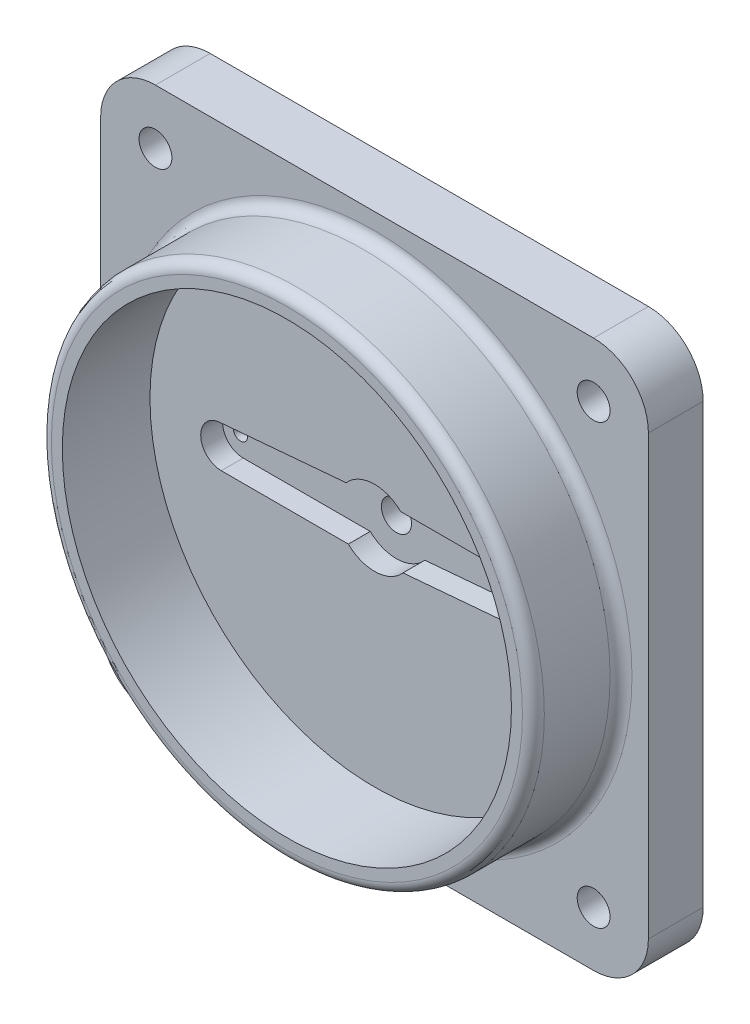
from build123d import *

# Parameters (mm, degrees)
ESQUISSE1_W             = 50
ESQUISSE1_H             = 50
BOSS_EXTRU_3_DEPTH      = 5
ESQUISSE3_R             = 22.5
ESQUISSE3_R_2           = 20.5
BOSS_EXTRU_4_DEPTH      = 8
ENL_V_MAT_EXTRU_1_DEPTH = 2
ESQUISSE5_R             = 0.65
ESQUISSE5_R_2           = 1.375
ENL_V_MAT_EXTRU_2_DEPTH = 37.742346142
CONG_1_R                = 5
ESQUISSE6_R             = 1.5
ENL_V_MAT_EXTRU_3_DEPTH = 37.249137921
CONG_2_R                = 1
CONG_3_R                = 1


with BuildPart() as part:
    # Esquisse1 → Boss.-Extru.3 (new body)
    with BuildSketch(Plane.XY):
        Rectangle(ESQUISSE1_W, ESQUISSE1_H)
    extrude(amount=BOSS_EXTRU_3_DEPTH)

    # Esquisse3 → Boss.-Extru.4 (add)
    with BuildSketch(Plane.XY.offset(5)):
        Circle(ESQUISSE3_R)
        Circle(ESQUISSE3_R_2, mode=Mode.SUBTRACT)
    extrude(amount=BOSS_EXTRU_4_DEPTH)

    # Esquisse4 → Enlèv. mat.-Extru.1 (cut)
    with BuildSketch(Plane.XY.offset(5)):
        with BuildLine():
            Line((-14.148131749, 1.273093878), (-2.594747862, 2.266121915))
            ThreePointArc((-2.594747862, 2.266121915), (-0.147642857, 3.44183477), (2.391155578, 2.48))
            Line((2.391155578, 2.48), (13.987136948, 2.48))
            ThreePointArc((13.987136948, 2.48), (15.866074919, 0.663183078), (14.113431719, -1.275753084))
            Line((14.113431719, -1.275753084), (2.594747862, -2.266121915))
            ThreePointArc((2.594747862, -2.266121915), (0.147642857, -3.44183477), (-2.391155578, -2.48))
            Line((-2.391155578, -2.48), (-13.987136948, -2.48))
            ThreePointArc((-13.987136948, -2.48), (-15.865409624, -0.680571429), (-14.148131749, 1.273093878))
        make_face()
    extrude(amount=-ENL_V_MAT_EXTRU_1_DEPTH, mode=Mode.SUBTRACT)

    # Esquisse5 → Enlèv. mat.-Extru.2 (cut, through all)
    with BuildSketch(Plane.XY.offset(3)):
        with Locations((-14.236907251, -0.610714286)):
            Circle(ESQUISSE5_R)
        with Locations((14.236907251, 0.610714286)):
            Circle(ESQUISSE5_R)
        Circle(ESQUISSE5_R_2)
    extrude(amount=-ENL_V_MAT_EXTRU_2_DEPTH, mode=Mode.SUBTRACT)

    # Congé1
    cong_1_edges = [part.edges().sort_by_distance(p)[0] for p in [
        (25, -25, 2.5),
        (-25, -25, 2.5),
        (-25, 25, 2.5),
        (25, 25, 2.5),
    ]]
    fillet(cong_1_edges, radius=CONG_1_R)

    # Esquisse6 → Enlèv. mat.-Extru.3 (cut, through all)
    with BuildSketch(Plane.XY.offset(5)):
        with Locations((-20, -20)):
            Circle(ESQUISSE6_R)
        with Locations((20, -20)):
            Circle(ESQUISSE6_R)
        with Locations((20, 20)):
            Circle(ESQUISSE6_R)
        with Locations((-20, 20)):
            Circle(ESQUISSE6_R)
    extrude(amount=-ENL_V_MAT_EXTRU_3_DEPTH, mode=Mode.SUBTRACT)

    # Congé2
    cong_2_edges = [part.edges().sort_by_distance(p)[0] for p in [
        (-22.5, 0, 5),
    ]]
    fillet(cong_2_edges, radius=CONG_2_R)

    # Congé3
    cong_3_edges = [part.edges().sort_by_distance(p)[0] for p in [
        (-22.5, 0, 13),
    ]]
    fillet(cong_3_edges, radius=CONG_3_R)


solid = part.part
